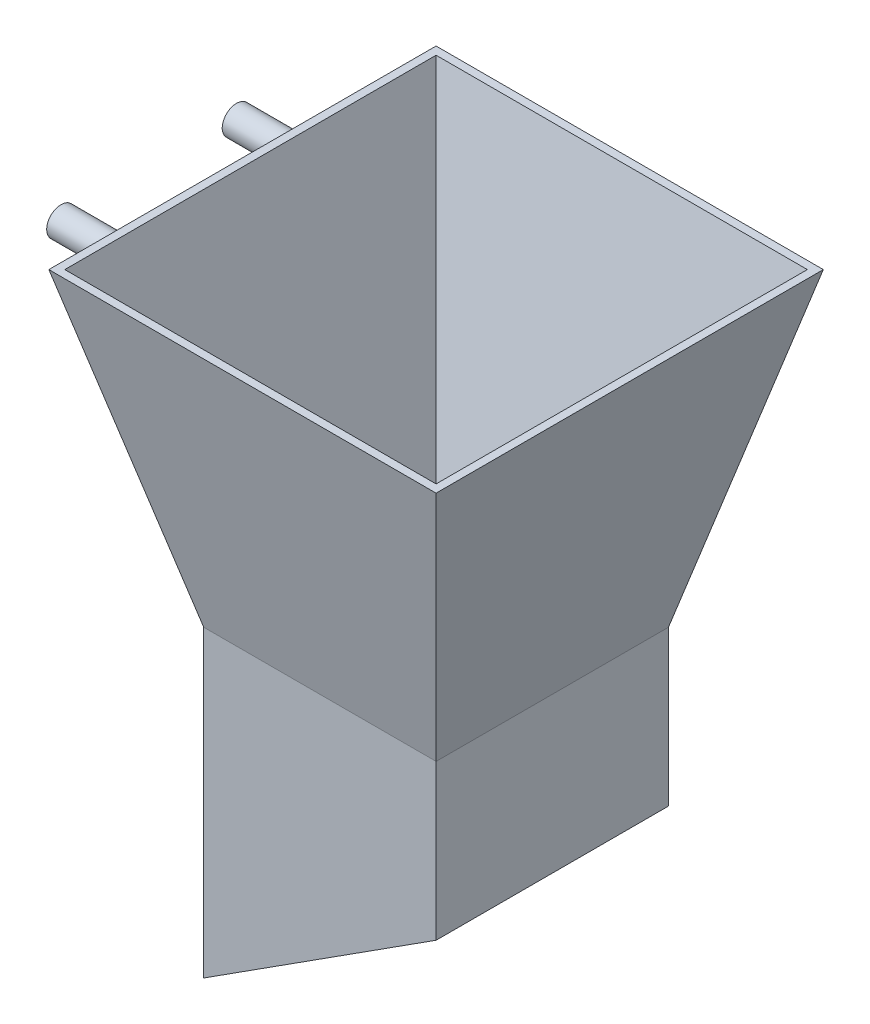
from build123d import *

# Parameters (mm, degrees)
CROQUIS4_W                     = 300
CROQUIS4_H                     = 300
SALIENTE_EXTRUIR1_DEPTH        = 200
SALIENTE_EXTRUIR2_DEPTH        = 300
VACIADO1_T                     = -10
SALIENTE_EXTRUIR3_DEPTH        = 10
SALIENTE_EXTRUIR3_DEPTH_BACK   = 121
CROQUIS6_R                     = 18.481607755
SALIENTE_EXTRUIR3_2_DEPTH      = 10
SALIENTE_EXTRUIR3_2_DEPTH_BACK = 121


with BuildPart() as part:
    # Croquis2 → Recubrir1 section 0
    with BuildSketch(Plane(origin=(0, 0, 0), x_dir=(1, 0, 0), z_dir=(0, 1, 0))):
        with BuildLine():
            Line((0, 0), (500, 0))
            Line((500, 0), (500, 500))
            Line((500, 500), (0, 500))
            Line((0, 500), (0, 0))
        make_face()
    # Croquis3 → Recubrir1 section 1
    with BuildSketch(Plane(origin=(0, -400, 0), x_dir=(1, 0, 0), z_dir=(0, 1, 0))):
        with BuildLine():
            Line((100, 400), (400, 400))
            Line((400, 400), (400, 100))
            Line((400, 100), (100, 100))
            Line((100, 100), (100, 400))
        make_face()
    loft()

    # Croquis4 → Saliente-Extruir1 (add)
    with BuildSketch(Plane.XZ.offset(400)):
        with Locations((250, -250)):
            Rectangle(CROQUIS4_W, CROQUIS4_H)
    extrude(amount=SALIENTE_EXTRUIR1_DEPTH)

    # Croquis5 → Saliente-Extruir2 (add)
    with BuildSketch(Plane.XY.offset(-100)):
        Polygon((100, -600), (100, -792.175192929), (400, -600), align=None)
    extrude(amount=-SALIENTE_EXTRUIR2_DEPTH)

    # Vaciado1
    vaciado1_openings = [part.faces().sort_by_distance(p)[0] for p in [
        (250, 0, -250),
    ]]
    offset(amount=VACIADO1_T, openings=vaciado1_openings, kind=Kind.INTERSECTION)


with BuildPart() as body_2:
    # Croquis6 → Saliente-Extruir3 (new, two sides: drawn at the far end of the back side and taken through both)
    with BuildSketch(Plane(origin=(0, 0, 0), x_dir=(0, 0, -1), z_dir=(1, 0, 0)).offset(-SALIENTE_EXTRUIR3_DEPTH_BACK)):
        with Locations((363.317119746, -74.725401963)):
            Circle(CROQUIS6_R)
    extrude(amount=SALIENTE_EXTRUIR3_DEPTH + SALIENTE_EXTRUIR3_DEPTH_BACK)


with BuildPart() as body_3:
    # Croquis6 → Saliente-Extruir3 2 (new, two sides: drawn at the far end of the back side and taken through both)
    with BuildSketch(Plane(origin=(0, 0, 0), x_dir=(0, 0, -1), z_dir=(1, 0, 0)).offset(-SALIENTE_EXTRUIR3_2_DEPTH_BACK)):
        with Locations(Location((136.682880254, -74.725401963, 0), (0, 0, 180))):
            Circle(CROQUIS6_R)
    extrude(amount=SALIENTE_EXTRUIR3_2_DEPTH + SALIENTE_EXTRUIR3_2_DEPTH_BACK)


solid = Compound([part.part, body_2.part, body_3.part])
